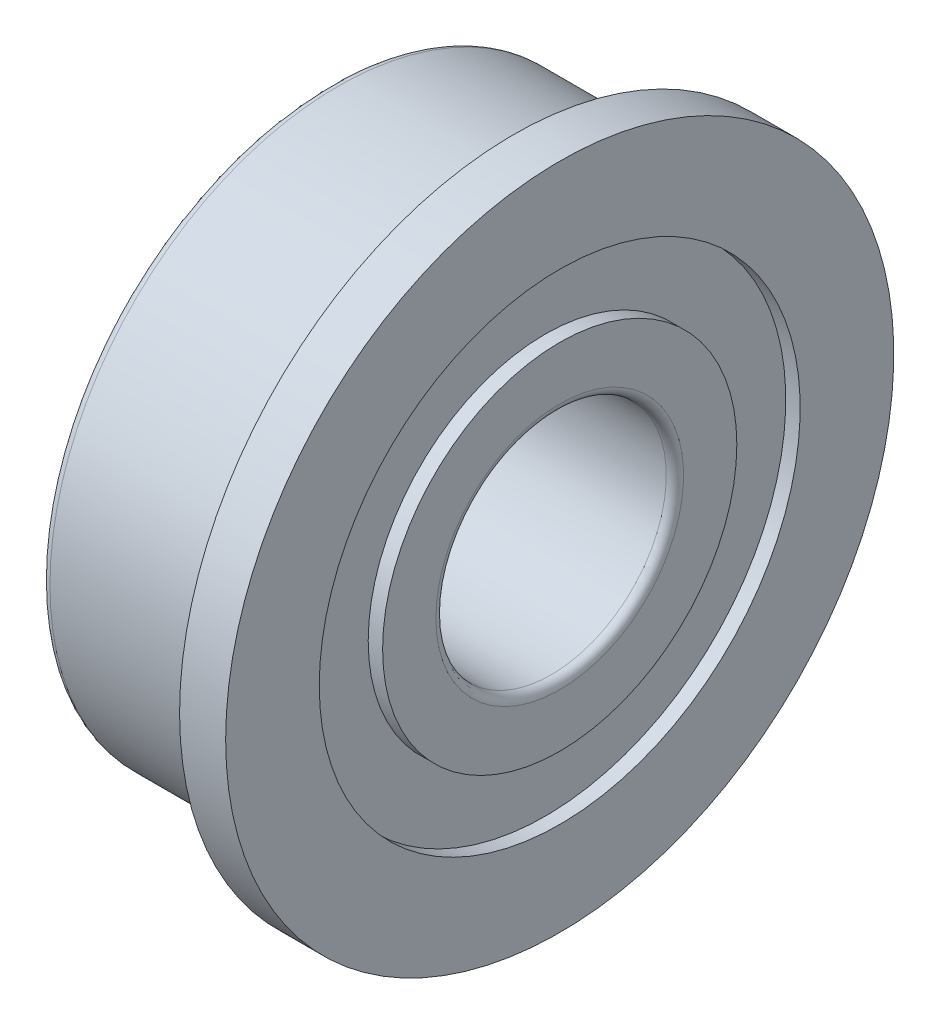
from build123d import *


with BuildPart() as part:
    # Sketch1 → Revolve1 (revolve)
    with BuildSketch(Plane.XY, mode=Mode.PRIVATE) as revolve1_sk:
        with BuildLine():
            Line((0, 4.85), (0, 4.175))
            Line((0, 4.175), (0.25, 4.175))
            Line((0.25, 4.175), (0.25, 3.075))
            Line((0.25, 3.075), (0, 3.075))
            Line((0, 3.075), (0, 2.15))
            ThreePointArc((0, 2.15), (0.043933983, 2.043933983), (0.15, 2))
            Line((0.15, 2), (3.85, 2))
            ThreePointArc((3.85, 2), (3.956066017, 2.043933983), (4, 2.15))
            Line((4, 2.15), (4, 3.075))
            Line((4, 3.075), (3.75, 3.075))
            Line((3.75, 3.075), (3.75, 4.175))
            Line((3.75, 4.175), (4, 4.175))
            Line((4, 4.175), (4, 5.8))
            Line((4, 5.8), (3.2, 5.8))
            Line((3.2, 5.8), (3.2, 5.2))
            ThreePointArc((3.2, 5.2), (3.341421356, 4.858578644), (3, 5))
            Line((3, 5), (0.15, 5))
            ThreePointArc((0.15, 5), (0.043933983, 4.956066017), (0, 4.85))
        make_face()
    revolve(revolve1_sk.sketch.rotate(Axis((10, 0, 0), (-1, 0, 0)), 270), axis=Axis((10, 0, 0), (-1, 0, 0)))


solid = part.part
